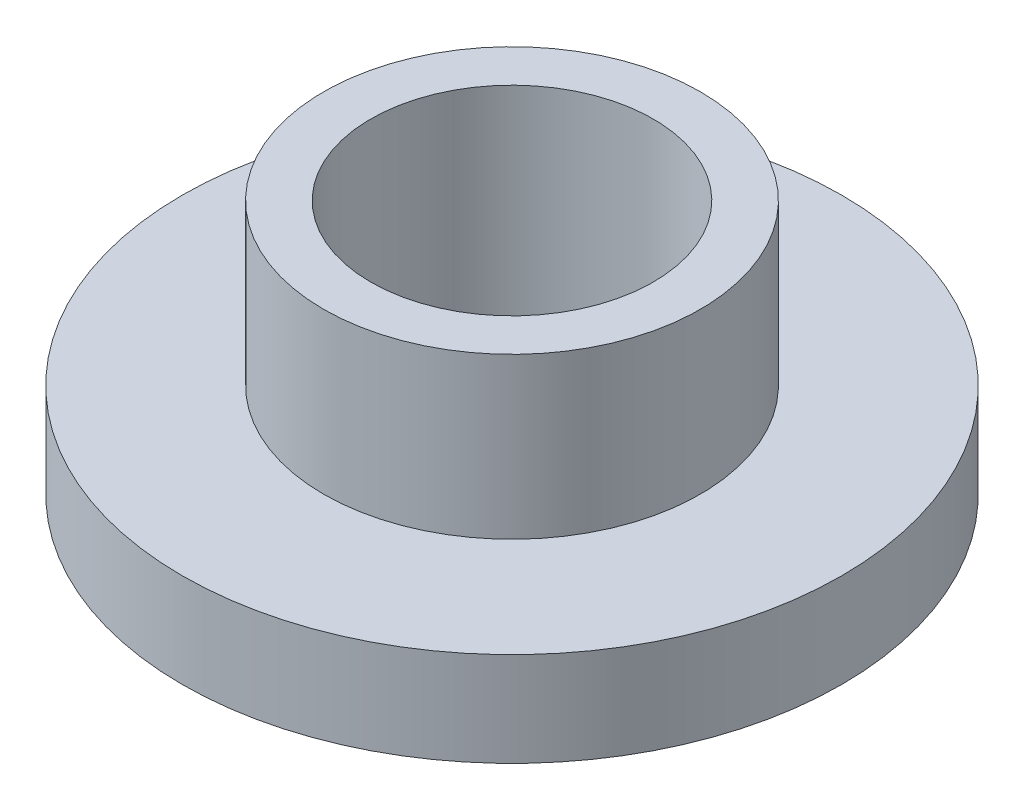
from build123d import *

# Parameters (mm, degrees)
SKETCH1_R           = 7
BOSS_EXTRUDE1_DEPTH = 2
SKETCH2_R           = 4
BOSS_EXTRUDE2_DEPTH = 3.4
SKETCH3_R           = 3
CUT_EXTRUDE1_DEPTH  = 12.276524287


with BuildPart() as part:
    # Sketch1 → Boss-Extrude1 (new body)
    with BuildSketch(Plane(origin=(0, 0, 0), x_dir=(1, 0, 0), z_dir=(0, 1, 0))):
        with Locations(Location((0, 0, 0), (0, 0, 270))):
            Circle(SKETCH1_R)
    extrude(amount=BOSS_EXTRUDE1_DEPTH)

    # Sketch2 → Boss-Extrude2 (add)
    with BuildSketch(Plane(origin=(0, 2, 0), x_dir=(1, 0, 0), z_dir=(0, 1, 0))):
        with Locations(Location((0, 0, 0), (0, 0, 270))):
            Circle(SKETCH2_R)
    extrude(amount=BOSS_EXTRUDE2_DEPTH)

    # Sketch3 → Cut-Extrude1 (cut, through all)
    with BuildSketch(Plane(origin=(0, 5.4, 0), x_dir=(1, 0, 0), z_dir=(0, 1, 0))):
        with Locations(Location((0, 0, 0), (0, 0, 270))):
            Circle(SKETCH3_R)
    extrude(amount=-CUT_EXTRUDE1_DEPTH, mode=Mode.SUBTRACT)


solid = part.part
